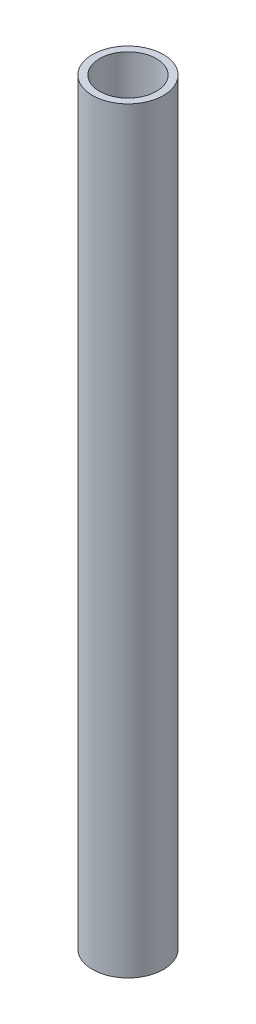
from build123d import *

# Parameters (mm, degrees)
SKETCH1_R           = 15
SKETCH1_R_2         = 12
BOSS_EXTRUDE1_DEPTH = 320


with BuildPart() as part:
    # Sketch1 → Boss-Extrude1 (new body)
    with BuildSketch(Plane(origin=(0, 0, 0), x_dir=(1, 0, 0), z_dir=(0, 1, 0))):
        with Locations(Location((0, 0, 0), (0, 0, 270))):
            Circle(SKETCH1_R)
        with Locations(Location((0, 0, 0), (0, 0, 270))):
            Circle(SKETCH1_R_2, mode=Mode.SUBTRACT)
    extrude(amount=BOSS_EXTRUDE1_DEPTH)


solid = part.part
